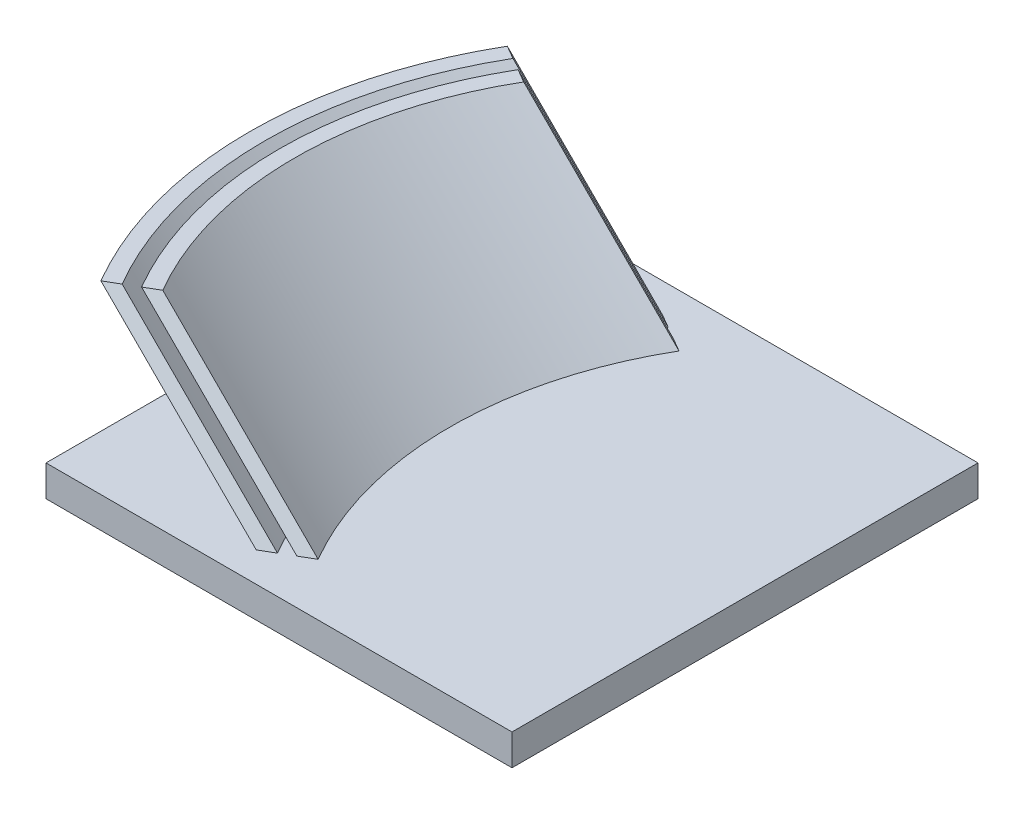
from build123d import *

# Parameters (mm, degrees)
SKETCH2_W           = 30
SKETCH2_H           = 30
BOSS_EXTRUDE1_DEPTH = 2


with BuildPart() as part:
    # Sketch2 → Boss-Extrude1 (new body)
    with BuildSketch(Plane(origin=(0, 0, 0), x_dir=(1, 0, 0), z_dir=(0, 1, 0))):
        Rectangle(SKETCH2_W, SKETCH2_H)
    extrude(amount=BOSS_EXTRUDE1_DEPTH)

    # Sweep1: sweep along a path in Sketch13
    with BuildLine(Plane.XY) as sweep1_path:
        Line((15, 2), (5, 12))
    # Sketch12 → Sweep1 (sweep)
    with BuildSketch(Plane(origin=(0, 2, 0), x_dir=(1, 0, 0), z_dir=(0, 1, 0))):
        with BuildLine():
            Line((-0.864419204, 11.616439262), (-1.728595106, 12.119629097))
            ThreePointArc((-1.728595106, 12.119629097), (-5, 0), (-1.728595106, -12.119629097))
            Line((-1.728595106, -12.119629097), (-0.864419204, -11.616439262))
            ThreePointArc((-0.864419204, -11.616439262), (-4, 0), (-0.864419204, 11.616439262))
        make_face()
        with BuildLine():
            Line((-2.518797551, 12.579745882), (-3.382973453, 13.082935717))
            ThreePointArc((-3.382973453, 13.082935717), (-6.9144, 0), (-3.382973453, -13.082935717))
            Line((-3.382973453, -13.082935717), (-2.518797551, -12.579745882))
            ThreePointArc((-2.518797551, -12.579745882), (-5.9144, 0), (-2.518797551, 12.579745882))
        make_face()
    sweep(path=sweep1_path.line)


solid = part.part
